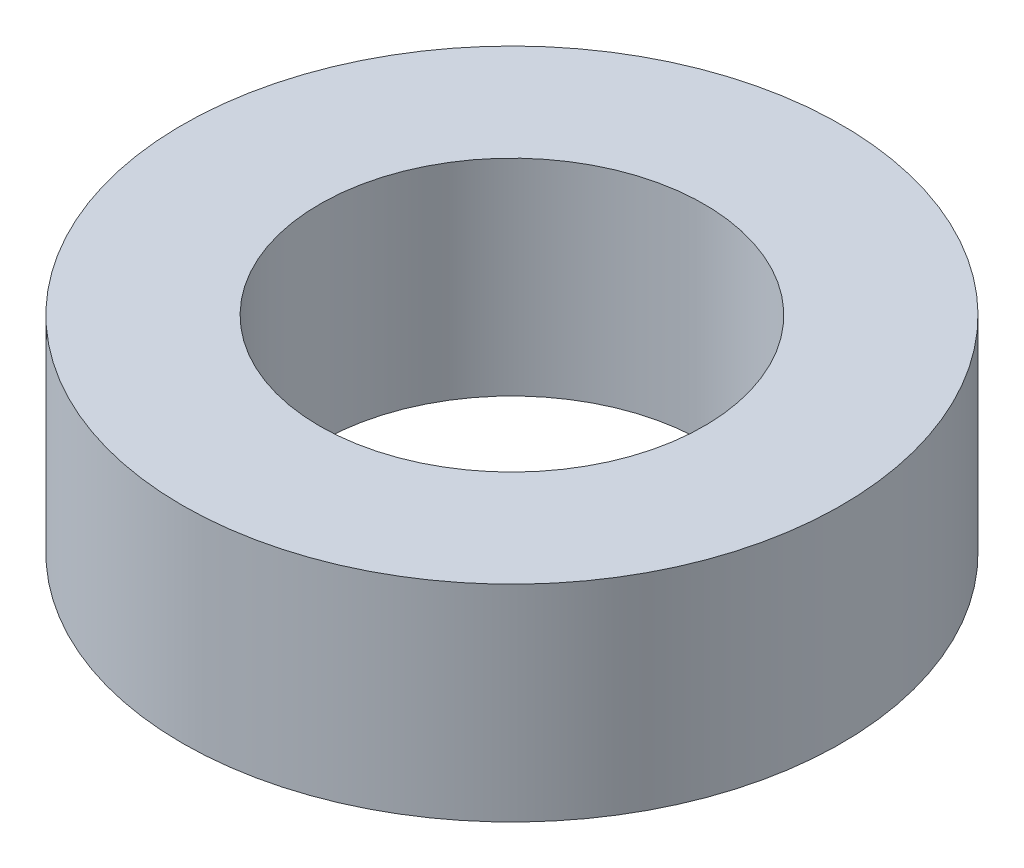
from build123d import *

# Parameters (mm, degrees)
SKIZZE1_R                       = 2.4
SKIZZE1_R_2                     = 1.4
AUFSATZ_LINEAR_AUSTRAGEN1_DEPTH = 1.5


with BuildPart() as part:
    # Skizze1 → Aufsatz-Linear austragen1 (new body)
    with BuildSketch(Plane(origin=(0, 0, 0), x_dir=(1, 0, 0), z_dir=(0, 1, 0))):
        with Locations(Location((0, 0, 0), (0, 0, 270))):
            Circle(SKIZZE1_R)
        with Locations(Location((0, 0, 0), (0, 0, 270))):
            Circle(SKIZZE1_R_2, mode=Mode.SUBTRACT)
    extrude(amount=AUFSATZ_LINEAR_AUSTRAGEN1_DEPTH)


solid = part.part
